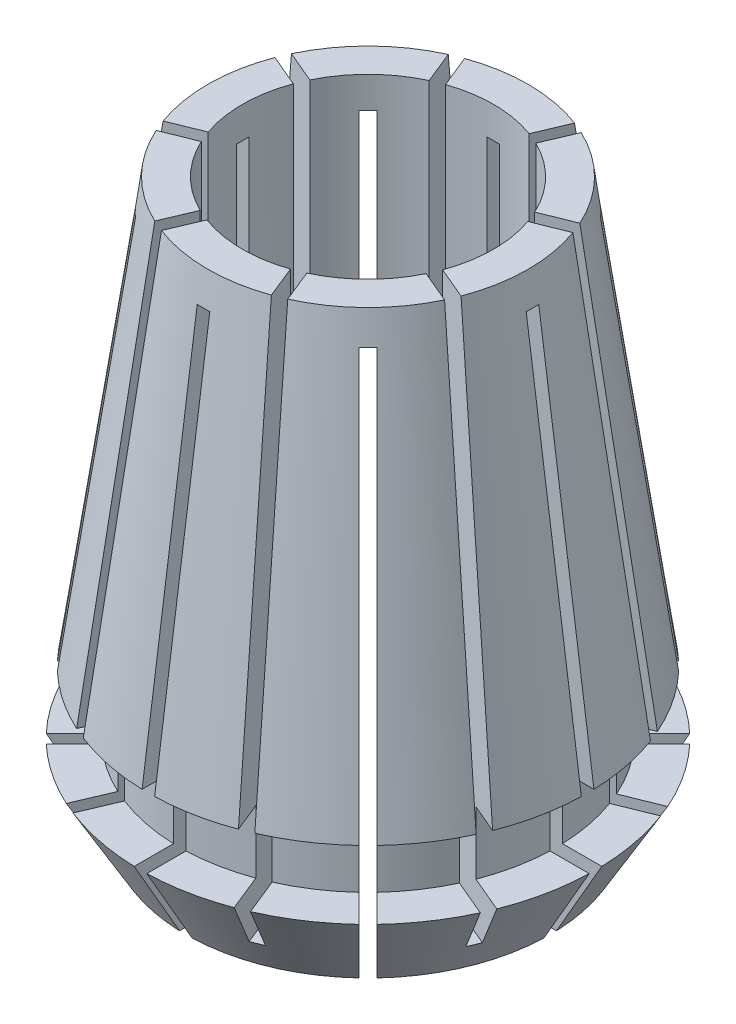
from build123d import *

# Parameters (mm, degrees)
SKETCH2_W               = 0.4
SKETCH2_H               = 3.255003129
EXTRUDED_CUT1_DEPTH     = 17
EXTRUDED_CUT2_DEPTH     = 17
CIRCULAR_PATTERN1_COUNT = 8


with BuildPart() as part:
    # Sketch1 → Rotation1 (revolve)
    with BuildSketch(Plane.XY):
        Polygon((-4, -4.5), (-4, 13.5), (-5.102698732, 13.5), (-7, 0), (-6, 0), (-6, -2), (-7.25, -2), (-5.806624327, -4.5), align=None)
    revolve(axis=Axis((0, 0, 0), (0, 1, 0)))

    # Sketch2 → Extruded Cut1 (cut)
    with BuildSketch(Plane.XZ.offset(4.5)):
        with Locations((0, 5.622498436)):
            Rectangle(SKETCH2_W, SKETCH2_H)
    extruded_cut1 = extrude(amount=-EXTRUDED_CUT1_DEPTH, mode=Mode.SUBTRACT)

    # Sketch3 → Extruded Cut2 (cut)
    with BuildSketch(Plane(origin=(0, 13.5, 0), x_dir=(1, 0, 0), z_dir=(0, 1, 0))):
        Polygon((-0.185436771, -0.074921319), (-2.901334573, 6.647161627), (-2.530461031, 6.797004264), (0.185436771, 0.074921319), align=None)
    extruded_cut2 = extrude(amount=-EXTRUDED_CUT2_DEPTH, mode=Mode.SUBTRACT)

    # Circular Pattern1: Extruded Cut1, Extruded Cut2 ×8 about axis
    circular_pattern1_axis = Axis((0, 13.5, 0), (0, -1, 0))
    add([extruded_cut1.rotate(circular_pattern1_axis, i * 360 / CIRCULAR_PATTERN1_COUNT) for i in range(1, CIRCULAR_PATTERN1_COUNT)], mode=Mode.SUBTRACT)
    add([extruded_cut2.rotate(circular_pattern1_axis, i * 360 / CIRCULAR_PATTERN1_COUNT) for i in range(1, CIRCULAR_PATTERN1_COUNT)], mode=Mode.SUBTRACT)


solid = part.part
